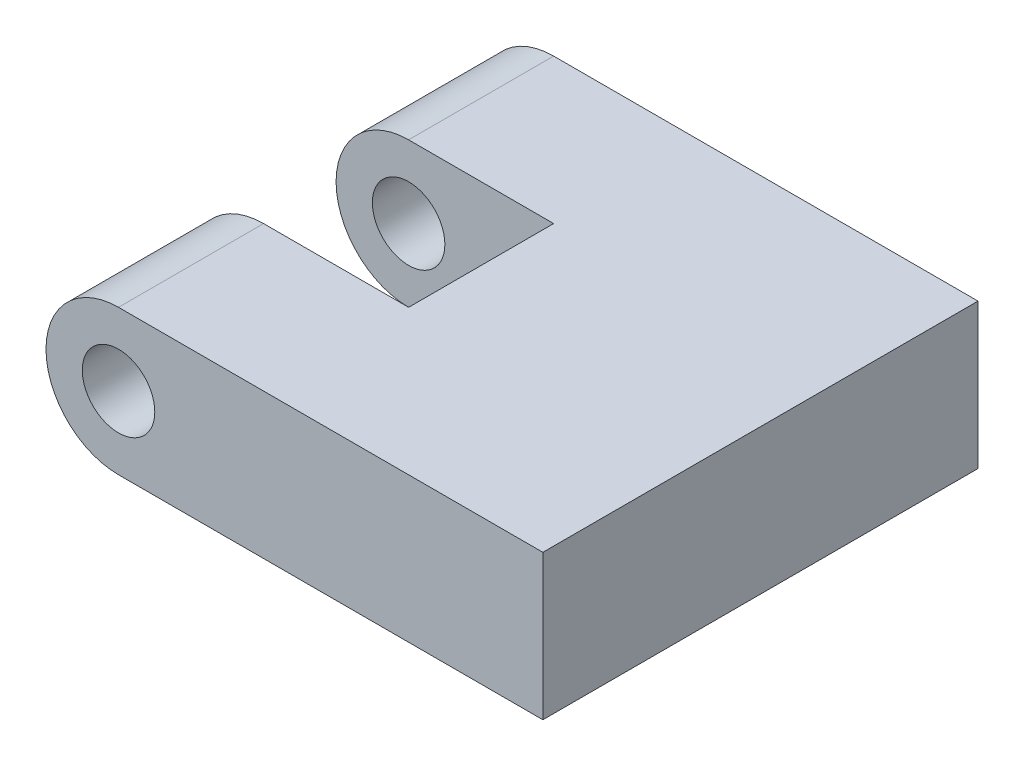
from build123d import *

# Parameters (mm, degrees)
SKETCH1_R               = 10
BOSS_EXTRUDE1_DEPTH     = 60
CUT_EXTRUDE1_DEPTH      = 20
CUT_EXTRUDE1_DEPTH_BACK = 40
SKETCH2_W               = 20
SKETCH2_H               = 28.944782362
SKETCH3_R               = 5
CUT_EXTRUDE3_DEPTH      = 120
SKETCH4_W               = 60
SKETCH4_H               = 20
BOSS_EXTRUDE2_DEPTH     = 5


with BuildPart() as part:
    # Sketch1 → Boss-Extrude1 (new body)
    with BuildSketch(Plane.XY):
        Circle(SKETCH1_R)
        with BuildLine():
            Line((53.512258846, 10), (0, 10))
            ThreePointArc((0, 10), (7.071067812, 7.071067812), (10, 0))
            ThreePointArc((10, 0), (7.071067812, -7.071067812), (0, -10))
            Line((0, -10), (53.512258846, -10))
            Line((53.512258846, -10), (53.512258846, 10))
        make_face()
    extrude(amount=BOSS_EXTRUDE1_DEPTH)

    # Sketch2 → Cut-Extrude1 (cut, two sides: drawn at the far end of the back side and taken through both)
    with BuildSketch(Plane(origin=(0, 0, 0), x_dir=(0, 0, -1), z_dir=(1, 0, 0)).offset(-CUT_EXTRUDE1_DEPTH_BACK)):
        with Locations((-30, 0)):
            Rectangle(SKETCH2_W, SKETCH2_H)
    extrude(amount=CUT_EXTRUDE1_DEPTH + CUT_EXTRUDE1_DEPTH_BACK, mode=Mode.SUBTRACT)

    # Sketch3 → Cut-Extrude3 (cut)
    with BuildSketch(Plane.XY.offset(60)):
        Circle(SKETCH3_R)
    extrude(amount=-CUT_EXTRUDE3_DEPTH, mode=Mode.SUBTRACT)

    # Sketch4 → Boss-Extrude2 (add)
    with BuildSketch(Plane(origin=(53.512258846, 0, 0), x_dir=(0, 0, -1), z_dir=(1, 0, 0))):
        with Locations((-30, 0)):
            Rectangle(SKETCH4_W, SKETCH4_H)
    extrude(amount=BOSS_EXTRUDE2_DEPTH)


solid = part.part
